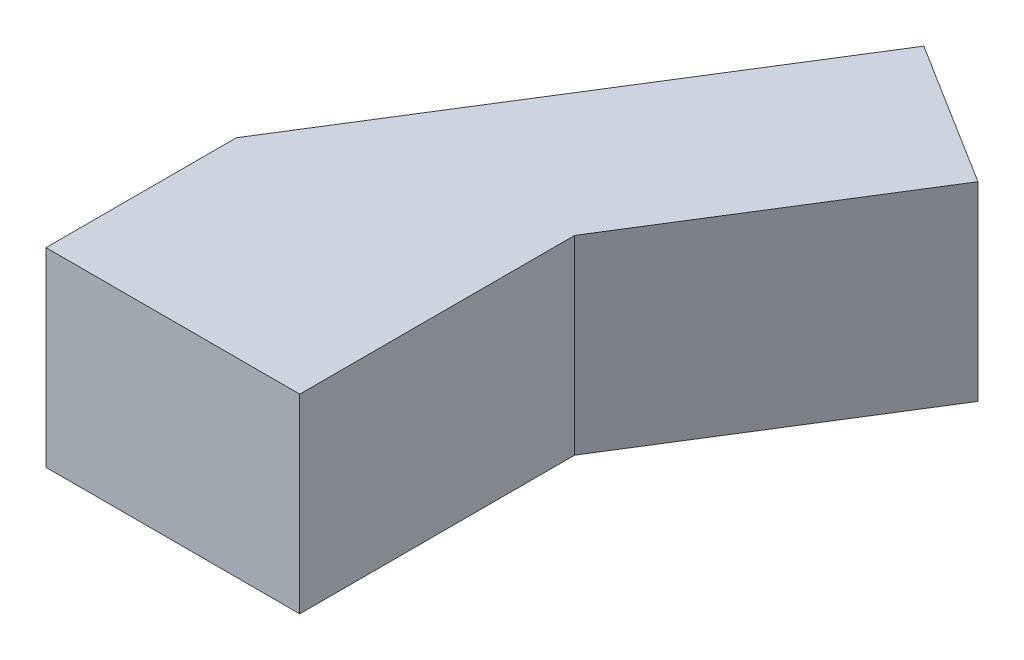
from build123d import *

# Parameters (mm, degrees)
EXTRUDE_1_DEPTH = 18


with BuildPart() as part:
    # 草图1 → 凸台-拉伸1 (new body)
    with BuildSketch(Plane(origin=(0, 0, 0), x_dir=(1, 0, 0), z_dir=(0, 1, 0))):
        Polygon((0, 0), (24, 0), (24, 26), (38.67278642, 49.481366746), (25.007508844, 58.020379889), (0, 18), align=None)
    extrude(amount=EXTRUDE_1_DEPTH)


solid = part.part
